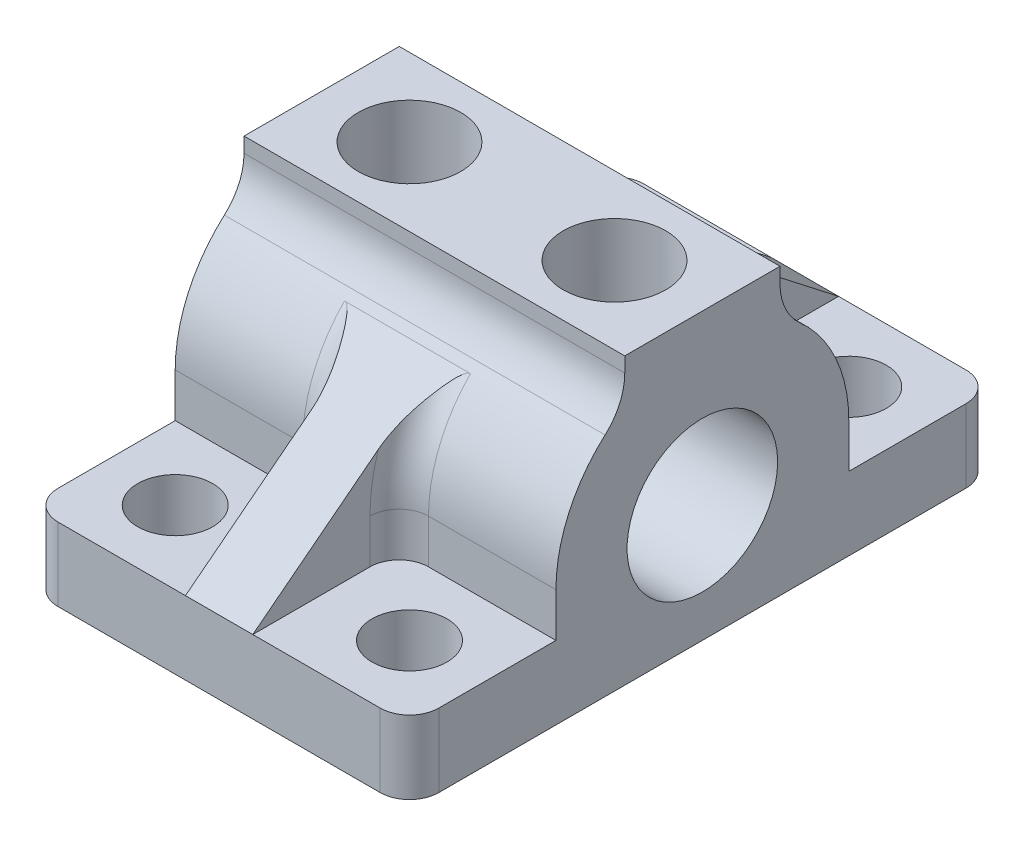
from build123d import *

# Parameters (mm, degrees)
SKETCH1_R           = 3.2639
BOSS_EXTRUDE1_DEPTH = 8.255
BOSS_EXTRUDE2_DEPTH = 1.4605
SKETCH3_R           = 1.6256
CUT_EXTRUDE1_DEPTH  = 18.250508688
CUT_EXTRUDE2_DEPTH  = 42.211451079
SKETCH6_W           = 16.51
SKETCH6_H           = 6.731
BOSS_EXTRUDE3_DEPTH = 1.905
SKETCH5_R           = 2.2225
CUT_EXTRUDE3_DEPTH  = 6.35
FILLET1_R           = 1.27
FILLET2_R           = 2.54


with BuildPart() as part:
    # Sketch1 → Boss-Extrude1 (new, symmetric)
    with BuildSketch(Plane(origin=(0, 0, 0), x_dir=(0, 0, -1), z_dir=(1, 0, 0))):
        with BuildLine():
            Line((12.7, 24.13), (-12.7, 24.13))
            Line((-12.7, 24.13), (-12.7, 27.305))
            Line((-12.7, 27.305), (-6.35, 27.305))
            Line((-6.35, 27.305), (-6.35, 29.21))
            ThreePointArc((-6.35, 29.21), (0, 35.56), (6.35, 29.21))
            Line((6.35, 29.21), (6.35, 27.305))
            Line((6.35, 27.305), (12.7, 27.305))
            Line((12.7, 27.305), (12.7, 24.13))
        make_face()
        with Locations((0, 29.21)):
            Circle(SKETCH1_R, mode=Mode.SUBTRACT)
    extrude(amount=BOSS_EXTRUDE1_DEPTH, both=True)

    # Sketch2 → Boss-Extrude2 (add, symmetric)
    with BuildSketch(Plane(origin=(0, 0, 0), x_dir=(0, 0, -1), z_dir=(1, 0, 0))):
        Polygon((-4.534807052, 33.655), (-12.7, 27.305), (-4.534807052, 27.305), align=None)
        Polygon((4.534807052, 27.305), (4.534807052, 33.655), (12.7, 27.305), align=None)
    extrude(amount=BOSS_EXTRUDE2_DEPTH, both=True)

    # Sketch3 → Cut-Extrude1 (cut, through all)
    with BuildSketch(Plane(origin=(0, 27.305, 0), x_dir=(1, 0, 0), z_dir=(0, 1, 0))):
        with Locations(Location((-5.08, 9.525, 0), (0, 0, 270))):
            Circle(SKETCH3_R)
        with Locations(Location((5.08, 9.525, 0), (0, 0, 90))):
            Circle(SKETCH3_R)
        with Locations(Location((5.08, -9.525, 0), (0, 0, 270))):
            Circle(SKETCH3_R)
        with Locations(Location((-5.08, -9.525, 0), (0, 0, 90))):
            Circle(SKETCH3_R)
    extrude(amount=-CUT_EXTRUDE1_DEPTH, mode=Mode.SUBTRACT)

    # Sketch4 → Cut-Extrude2 (cut, through all)
    with BuildSketch(Plane(origin=(8.255, 0, 0), x_dir=(0, 0, -1), z_dir=(1, 0, 0))):
        with BuildLine():
            Line((3.3655, 34.594785024), (-3.3655, 34.594785024))
            ThreePointArc((-3.3655, 34.594785024), (0, 35.56), (3.3655, 34.594785024))
        make_face()
    extrude(amount=-CUT_EXTRUDE2_DEPTH, mode=Mode.SUBTRACT)

    # Sketch6 → Boss-Extrude3 (add)
    with BuildSketch(Plane(origin=(0, 34.594785024, 0), x_dir=(1, 0, 0), z_dir=(0, 1, 0))):
        Rectangle(SKETCH6_W, SKETCH6_H)
    extrude(amount=BOSS_EXTRUDE3_DEPTH)

    # Sketch5 → Cut-Extrude3 (cut)
    with BuildSketch(Plane(origin=(0, 36.499785024, 0), x_dir=(1, 0, 0), z_dir=(0, 1, 0))):
        with Locations(Location((-4.445, 0, 0), (0, 0, 270))):
            Circle(SKETCH5_R)
        with Locations(Location((4.445, 0, 0), (0, 0, 270))):
            Circle(SKETCH5_R)
    extrude(amount=-CUT_EXTRUDE3_DEPTH, mode=Mode.SUBTRACT)

    # Fillet1
    fillet1_edges = [part.edges().sort_by_distance(p)[0] for p in [
        (-8.255, 25.7175, -12.7),
        (-8.255, 25.7175, 12.7),
        (8.255, 25.7175, -12.7),
        (1.4605, 28.2575, 6.35),
        (1.4605, 31.610674407, 5.878712647),
        (-1.4605, 28.2575, 6.35),
        (-1.4605, 31.610674407, 5.878712647),
        (-1.4605, 28.2575, -6.35),
        (1.4605, 28.2575, -6.35),
        (8.255, 25.7175, 12.7),
        (1.4605, 31.610674407, -5.878712647),
        (-1.4605, 31.610674407, -5.878712647),
    ]]
    fillet(fillet1_edges, radius=FILLET1_R)

    # Fillet2
    fillet2_edges = [part.edges().sort_by_distance(p)[0] for p in [
        (0, 34.594785024, 3.3655),
        (0, 34.594785024, -3.3655),
    ]]
    fillet(fillet2_edges, radius=FILLET2_R)


solid = part.part
